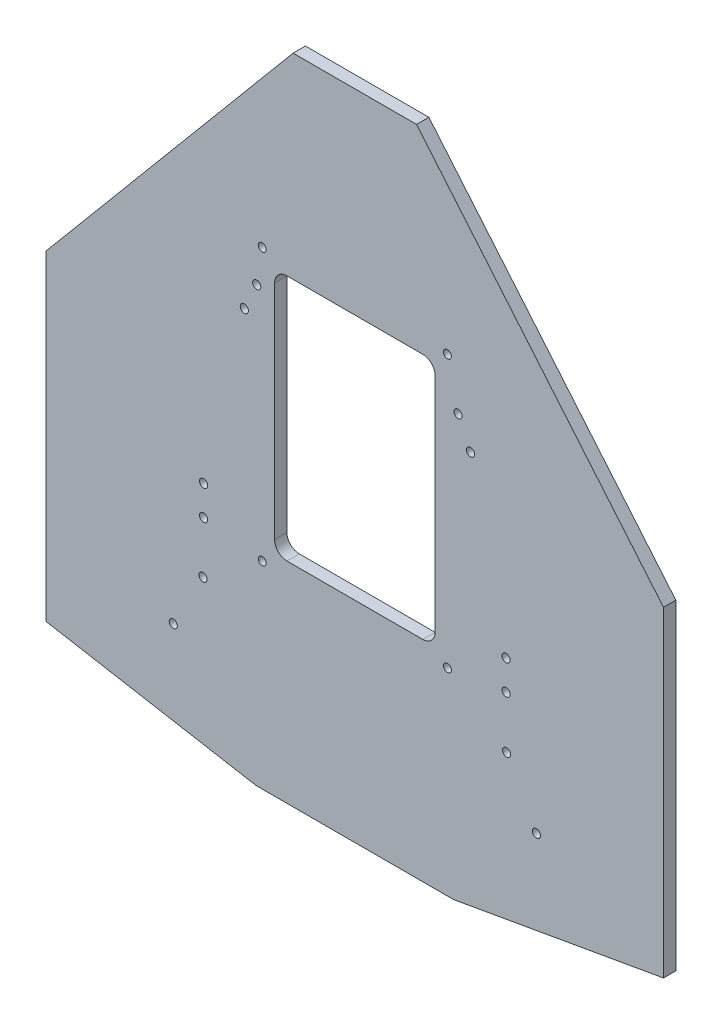
from build123d import *

# Parameters (mm, degrees)
SKETCH_1_W                  = 65
SKETCH_1_H                  = 100
EXTRUDE_1_DEPTH             = 5
SKETCH_2_R                  = 1.6
CUT_EXTRUDE_1_DEPTH         = 5
PATTERN_LINEAR_1_COUNT      = 2
PATTERN_LINEAR_1_PITCH      = 75
PATTERN_LINEAR_1_COUNT_DIR2 = 2
PATTERN_LINEAR_1_PITCH_DIR2 = 110
FILLET_1_R                  = 5
SKETCH_4_R                  = 1.65
CUT_EXTRUDE_2_DEPTH         = 31


with BuildPart() as part:
    # Эскиз1 → Бобышка-Вытянуть1 (new body)
    with BuildSketch(Plane.XY):
        Polygon((-35, -48), (-35, -58), (50, -73), (130, -73), (215, -58), (215, -48), (215, 62), (215, 72), (115, 191.360256276), (65, 191.360256276), (-35, 72), (-35, 62), align=None)
        with Locations((90, 62)):
            Rectangle(SKETCH_1_W, SKETCH_1_H, mode=Mode.SUBTRACT)
    extrude(amount=EXTRUDE_1_DEPTH)

    # Эскиз2 → Вырез-Вытянуть1 (cut)
    with BuildSketch(Plane.XY.offset(5)):
        with Locations((52.5, 7)):
            Circle(SKETCH_2_R)
    cut_extrude_1 = extrude(amount=-CUT_EXTRUDE_1_DEPTH, mode=Mode.SUBTRACT)

    # Линейный массив1: Cut-Extrude 1 2 × 2
    with Locations(*[(i * PATTERN_LINEAR_1_PITCH, j * PATTERN_LINEAR_1_PITCH_DIR2, 0) for i in range(PATTERN_LINEAR_1_COUNT) for j in range(PATTERN_LINEAR_1_COUNT_DIR2) if (i, j) != (0, 0)]):
        add(cut_extrude_1, mode=Mode.SUBTRACT)

    # Скругление1
    fillet_1_edges = [part.edges().sort_by_distance(p)[0] for p in [
        (122.5, 112, 2.5),
        (57.5, 112, 2.5),
        (57.5, 12, 2.5),
        (122.5, 12, 2.5),
    ]]
    fillet(fillet_1_edges, radius=FILLET_1_R)

    # Эскиз4 → Вырез-Вытянуть2 (cut)
    with BuildSketch(Plane(origin=(0, 0, 0), x_dir=(-1, 0, 0), z_dir=(0, 0, -1))):
        with Locations((-16.471095772, -33)):
            Circle(SKETCH_4_R)
        with Locations((-28.528904228, -10.64)):
            Circle(SKETCH_4_R)
        with Locations((-28.75, 22.36)):
            Circle(SKETCH_4_R)
        with Locations((-28.75, 10.36)):
            Circle(SKETCH_4_R)
        with Locations((-45.245579603, 91.884303707)):
            Circle(SKETCH_4_R)
        with Locations((-50.274277733, 102.779816321)):
            Circle(SKETCH_4_R)
        with Locations((-131.821084869, 98.239864017)):
            Circle(SKETCH_4_R)
        with Locations((-136.849782999, 87.344351403)):
            Circle(SKETCH_4_R)
        with Locations((-151.471095772, -10.64)):
            Circle(SKETCH_4_R)
        with Locations((-163.528904228, -33)):
            Circle(SKETCH_4_R)
        with Locations((-151.25, 22.36)):
            Circle(SKETCH_4_R)
        with Locations((-151.25, 10.36)):
            Circle(SKETCH_4_R)
    extrude(amount=-CUT_EXTRUDE_2_DEPTH, mode=Mode.SUBTRACT)


solid = part.part
